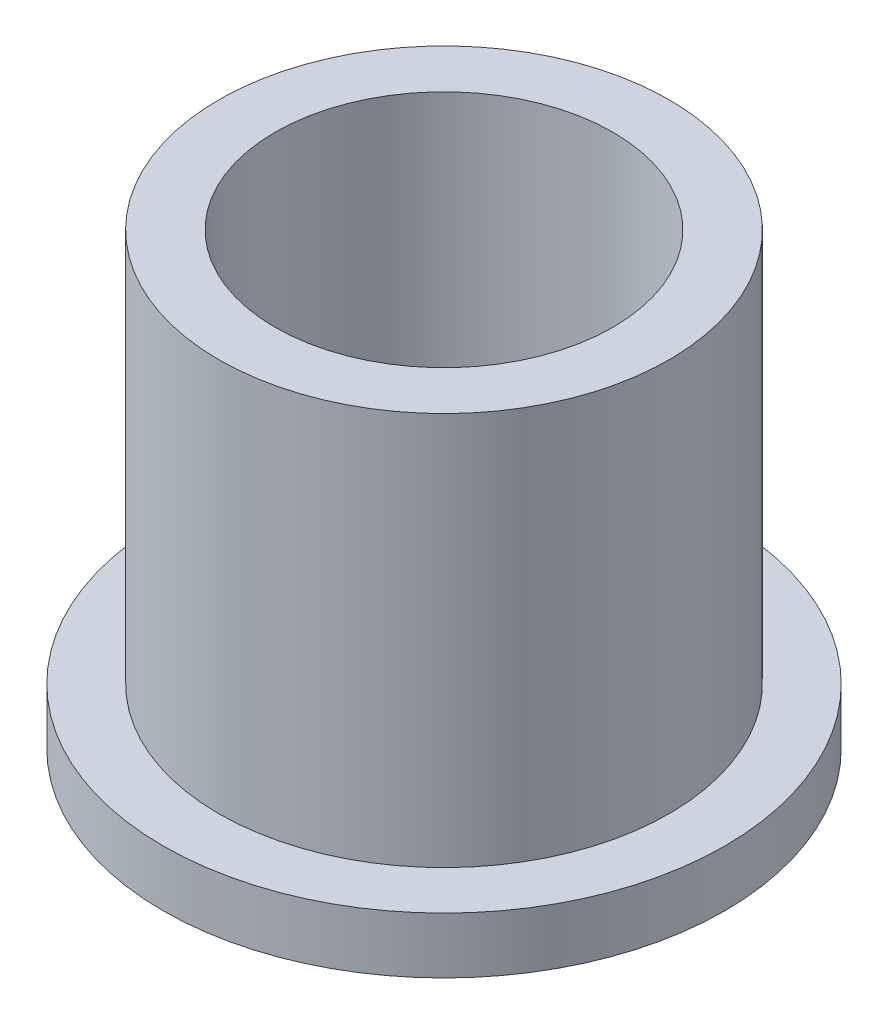
from build123d import *

# Parameters (mm, degrees)
SKETCH2_R           = 6.3627
SKETCH2_R_2         = 4.7752
BOSS_EXTRUDE1_DEPTH = 12.7
SKETCH3_R           = 7.9375
SKETCH3_R_2         = 6.3627
BOSS_EXTRUDE2_DEPTH = 1.5875


with BuildPart() as part:
    # Sketch2 → Boss-Extrude1 (new body)
    with BuildSketch(Plane(origin=(0, 0, 0), x_dir=(1, 0, 0), z_dir=(0, 1, 0))):
        with Locations(Location((0, 0, 0), (0, 0, 270))):
            Circle(SKETCH2_R)
        with Locations(Location((0, 0, 0), (0, 0, 270))):
            Circle(SKETCH2_R_2, mode=Mode.SUBTRACT)
    extrude(amount=BOSS_EXTRUDE1_DEPTH)

    # Sketch3 → Boss-Extrude2 (add)
    with BuildSketch(Plane(origin=(0, 0, 0), x_dir=(1, 0, 0), z_dir=(0, 1, 0))):
        with Locations(Location((0, 0, 0), (0, 0, 270))):
            Circle(SKETCH3_R)
        with Locations(Location((0, 0, 0), (0, 0, 270))):
            Circle(SKETCH3_R_2, mode=Mode.SUBTRACT)
    extrude(amount=BOSS_EXTRUDE2_DEPTH)


solid = part.part
